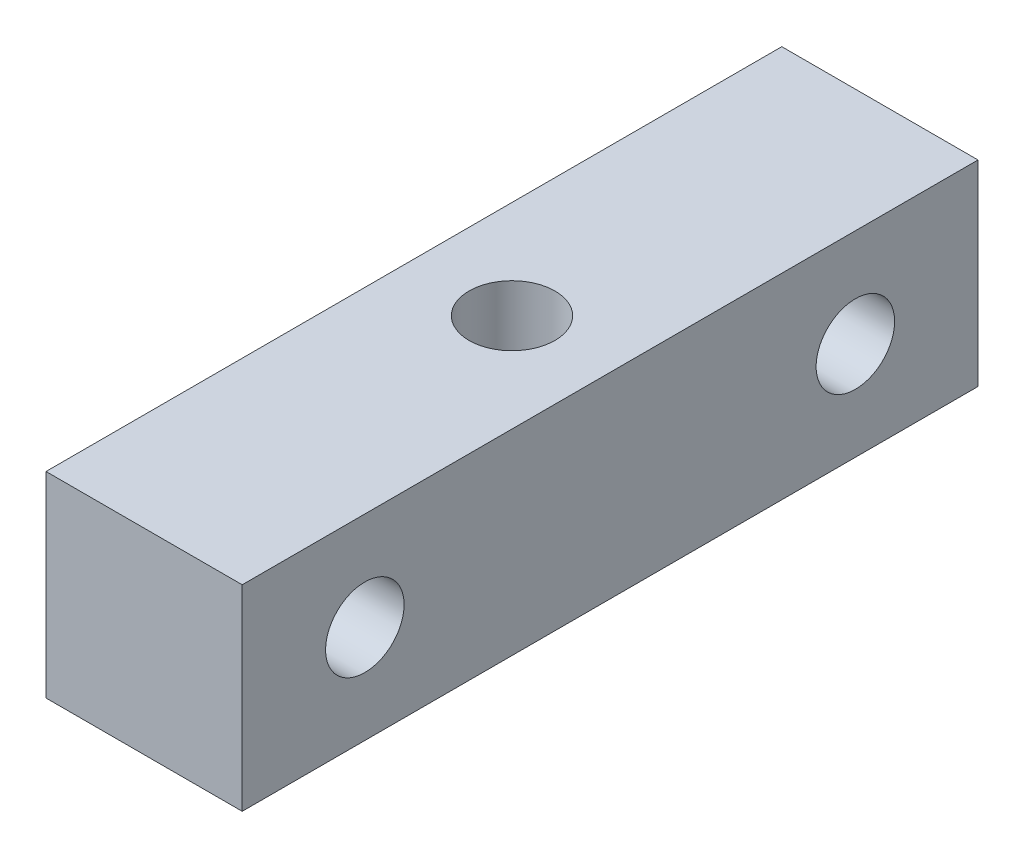
from build123d import *

# Parameters (mm, degrees)
SKETCH_2_W          = 8
SKETCH_2_H          = 8
EXTRUDE_1_DEPTH     = 30
SKETCH_3_R          = 1.75
CUT_EXTRUDE_1_DEPTH = 32.304951685
SKETCH_4_R          = 1.6
CUT_EXTRUDE_2_DEPTH = 32.304951685


with BuildPart() as part:
    # 草图2 → 凸台-拉伸1 (new body)
    with BuildSketch(Plane.XY):
        Rectangle(SKETCH_2_W, SKETCH_2_H)
    extrude(amount=EXTRUDE_1_DEPTH)

    # 草图3 → 切除-拉伸1 (cut, through all)
    with BuildSketch(Plane(origin=(0, 4, 0), x_dir=(1, 0, 0), z_dir=(0, 1, 0))):
        with Locations(Location((0, -15, 0), (0, 0, 270))):
            Circle(SKETCH_3_R)
    extrude(amount=-CUT_EXTRUDE_1_DEPTH, mode=Mode.SUBTRACT)

    # 草图4 → 切除-拉伸2 (cut, through all)
    with BuildSketch(Plane(origin=(4, 0, 0), x_dir=(0, 0, -1), z_dir=(1, 0, 0))):
        with Locations((-25, 0)):
            Circle(SKETCH_4_R)
        with Locations((-5, 0)):
            Circle(SKETCH_4_R)
    extrude(amount=-CUT_EXTRUDE_2_DEPTH, mode=Mode.SUBTRACT)


solid = part.part
